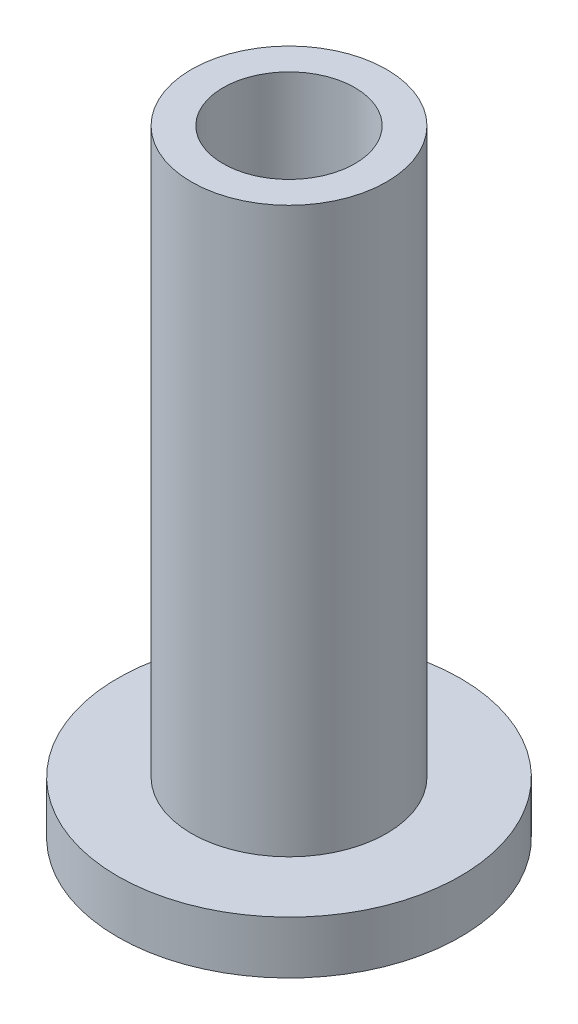
from build123d import *

# Parameters (mm, degrees)
SKETCH1_R           = 4.1275
BOSS_EXTRUDE1_DEPTH = 1.27
SKETCH2_R           = 2.3495
BOSS_EXTRUDE2_DEPTH = 13.589
SKETCH3_R           = 1.5875
CUT_EXTRUDE2_DEPTH  = 16.964410215


with BuildPart() as part:
    # Sketch1 → Boss-Extrude1 (new body)
    with BuildSketch(Plane(origin=(0, 0, 0), x_dir=(1, 0, 0), z_dir=(0, 1, 0))):
        with Locations(Location((0, 0, 0), (0, 0, 270))):
            Circle(SKETCH1_R)
    extrude(amount=BOSS_EXTRUDE1_DEPTH)

    # Sketch2 → Boss-Extrude2 (add)
    with BuildSketch(Plane(origin=(0, 1.27, 0), x_dir=(1, 0, 0), z_dir=(0, 1, 0))):
        with Locations(Location((0, 0, 0), (0, 0, 270))):
            Circle(SKETCH2_R)
    extrude(amount=BOSS_EXTRUDE2_DEPTH)

    # Sketch3 → Cut-Extrude2 (cut, through all)
    with BuildSketch(Plane.XZ):
        with Locations(Location((0, 0, 0), (0, 0, 270))):
            Circle(SKETCH3_R)
    extrude(amount=-CUT_EXTRUDE2_DEPTH, mode=Mode.SUBTRACT)


solid = part.part
